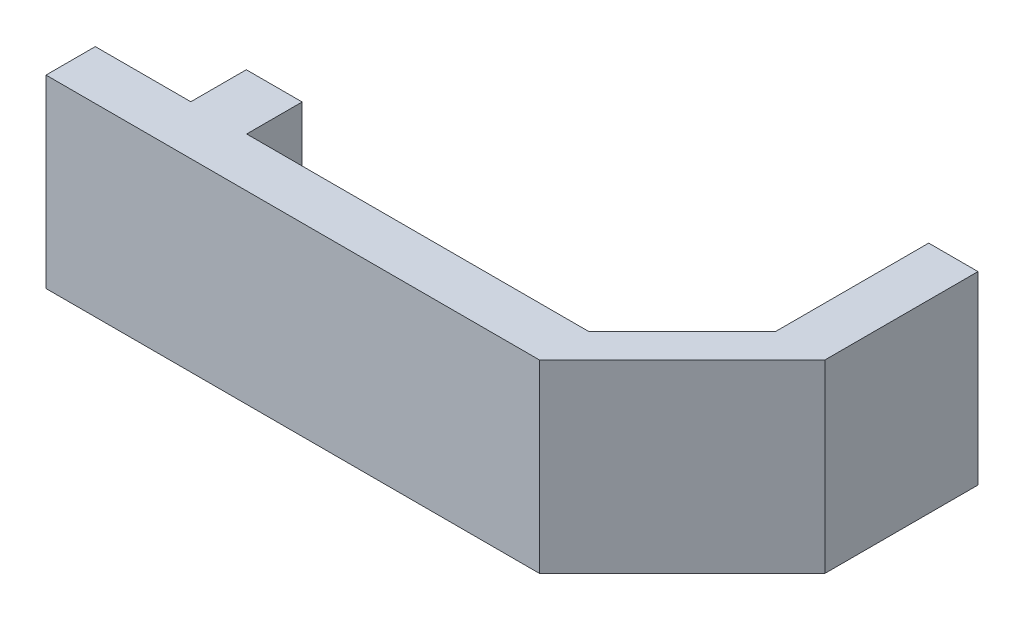
from build123d import *

# Parameters (mm, degrees)
EXTRUDE_1_DEPTH = 15


with BuildPart() as part:
    # 草圖1 → 填料-伸長1 (new body)
    with BuildSketch(Plane(origin=(0, 0, 0), x_dir=(1, 0, 0), z_dir=(0, 1, 0))):
        Polygon((-27.501723192, 6.859259259), (-22.971723192, 6.859259259), (-22.971723192, 2.359259259), (4.778276808, 2.359259259), (12.361610141, 9.942592593), (12.361610141, 22.359259259), (16.361610141, 22.359259259), (16.361610141, 9.942592593), (4.778276808, -1.640740741), (-35.251723192, -1.640740741), (-35.251723192, 2.359259259), (-27.501723192, 2.359259259), align=None)
    extrude(amount=EXTRUDE_1_DEPTH)


solid = part.part
